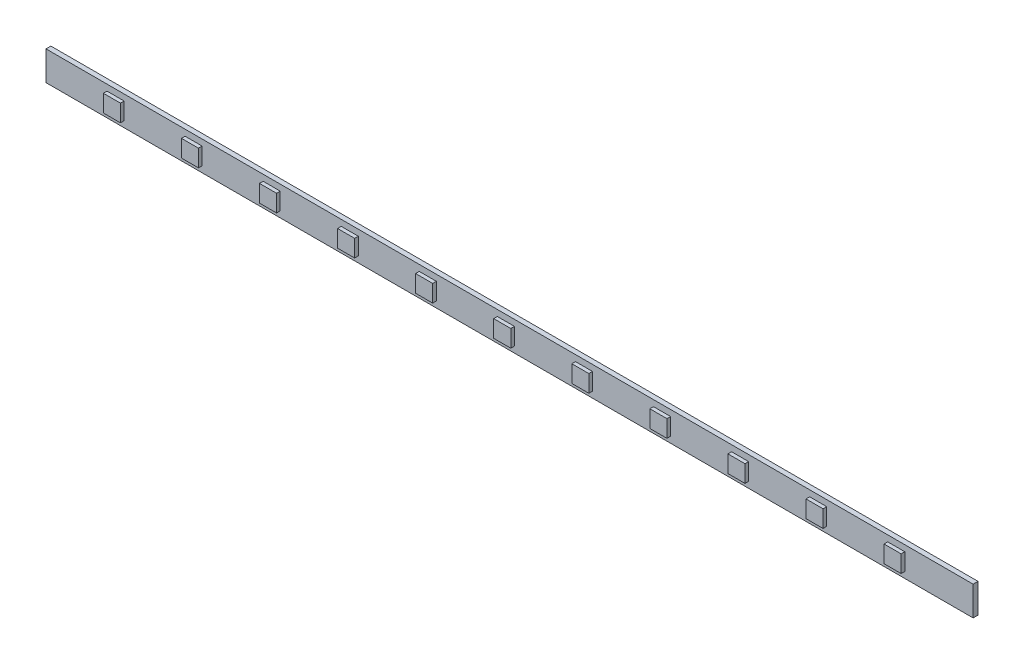
from build123d import *

# Parameters (mm, degrees)
SKETCH1_W           = 380
SKETCH1_H           = 12
BOSS_EXTRUDE1_DEPTH = 2
SKETCH2_W           = 7
SKETCH2_H           = 7
BOSS_EXTRUDE2_DEPTH = 1.5


with BuildPart() as part:
    # Sketch1 → Boss-Extrude1 (new body)
    with BuildSketch(Plane.XY):
        with Locations((190, 6)):
            Rectangle(SKETCH1_W, SKETCH1_H)
    extrude(amount=BOSS_EXTRUDE1_DEPTH)

    # Sketch2 → Boss-Extrude2 (add)
    with BuildSketch(Plane.XY.offset(2)):
        with Locations((28.5, 6)):
            Rectangle(SKETCH2_W, SKETCH2_H)
        with Locations((60.5, 6)):
            Rectangle(SKETCH2_W, SKETCH2_H)
        with Locations((92.5, 6)):
            Rectangle(SKETCH2_W, SKETCH2_H)
        with Locations((124.5, 6)):
            Rectangle(SKETCH2_W, SKETCH2_H)
        with Locations((156.5, 6)):
            Rectangle(SKETCH2_W, SKETCH2_H)
        with Locations((188.5, 6)):
            Rectangle(SKETCH2_W, SKETCH2_H)
        with Locations((220.5, 6)):
            Rectangle(SKETCH2_W, SKETCH2_H)
        with Locations((252.5, 6)):
            Rectangle(SKETCH2_W, SKETCH2_H)
        with Locations((284.5, 6)):
            Rectangle(SKETCH2_W, SKETCH2_H)
        with Locations((316.5, 6)):
            Rectangle(SKETCH2_W, SKETCH2_H)
        with Locations((348.5, 6)):
            Rectangle(SKETCH2_W, SKETCH2_H)
    extrude(amount=BOSS_EXTRUDE2_DEPTH)


solid = part.part
